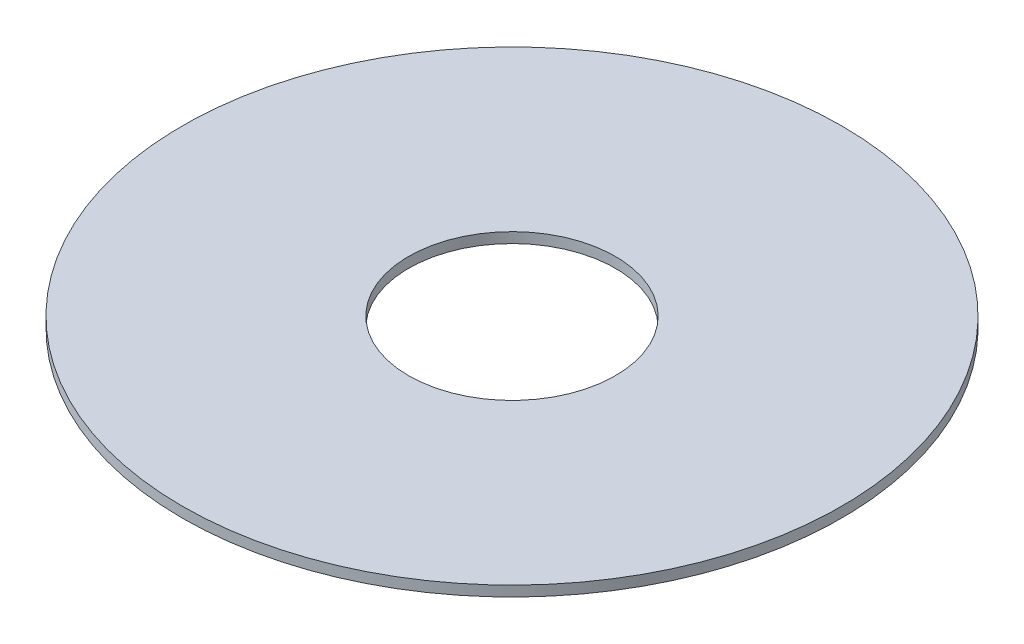
from build123d import *

# Parameters (mm, degrees)
SKETCH1_R           = 80.9625
SKETCH1_R_2         = 25.4
BOSS_EXTRUDE1_DEPTH = 2.54


with BuildPart() as part:
    # Sketch1 → Boss-Extrude1 (new body)
    with BuildSketch(Plane(origin=(0, 0, 0), x_dir=(1, 0, 0), z_dir=(0, 1, 0))):
        with Locations(Location((0, 0, 0), (0, 0, 270))):
            Circle(SKETCH1_R)
        with Locations(Location((0, 0, 0), (0, 0, 270))):
            Circle(SKETCH1_R_2, mode=Mode.SUBTRACT)
    extrude(amount=BOSS_EXTRUDE1_DEPTH)


solid = part.part
